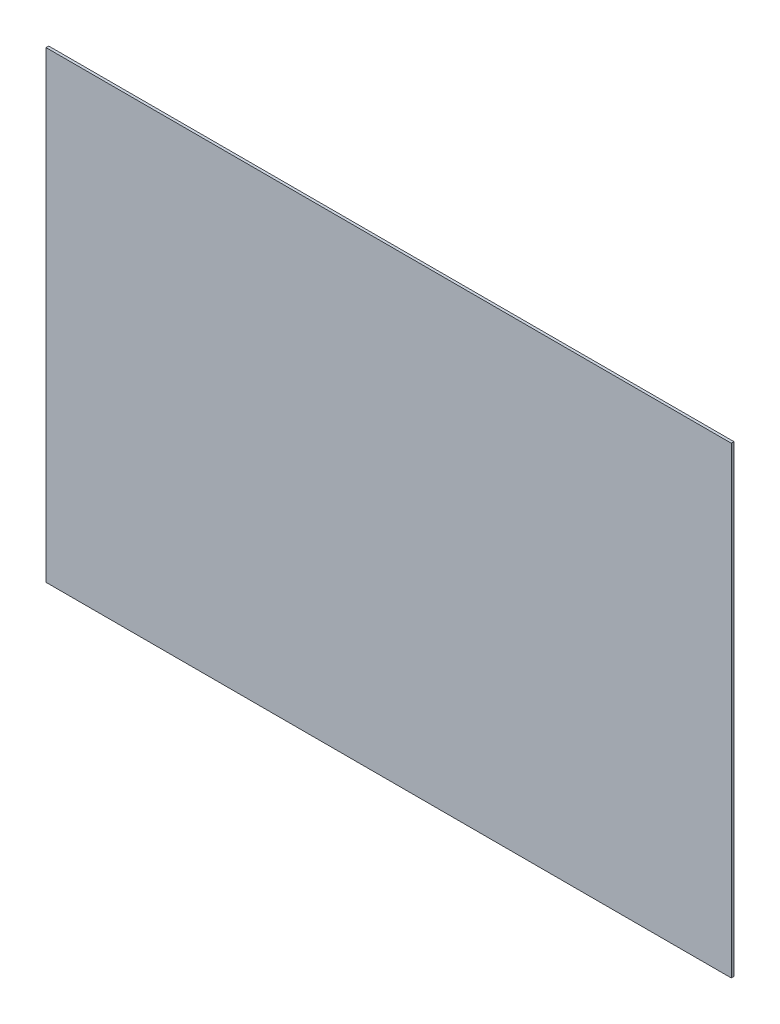
from build123d import *

# Parameters (mm, degrees)
SKETCH1_W           = 254.5
SKETCH1_H           = 172
BOSS_EXTRUDE1_DEPTH = 1
SKETCH2_W           = 230
SKETCH2_H           = 148
BOSS_EXTRUDE2_DEPTH = 9
SKETCH3_R           = 1.75
CUT_EXTRUDE1_DEPTH  = 2


with BuildPart() as part:
    # Sketch1 → Boss-Extrude1 (new body)
    with BuildSketch(Plane.XY):
        Rectangle(SKETCH1_W, SKETCH1_H)
    extrude(amount=BOSS_EXTRUDE1_DEPTH)

    # Sketch2 → Boss-Extrude2 (add)
    with BuildSketch(Plane(origin=(0, 0, 0), x_dir=(-1, 0, 0), z_dir=(0, 0, -1))):
        with Locations((0, -2.5)):
            Rectangle(SKETCH2_W, SKETCH2_H)
    extrude(amount=BOSS_EXTRUDE2_DEPTH)

    # Sketch3 → Cut-Extrude1 (cut)
    with BuildSketch(Plane(origin=(0, 0, -9), x_dir=(-1, 0, 0), z_dir=(0, 0, -1))):
        with Locations((29, -26.5)):
            Circle(SKETCH3_R)
        with Locations((-29, -26.5)):
            Circle(SKETCH3_R)
        with Locations((-29, 22.5)):
            Circle(SKETCH3_R)
        with Locations((29, 22.5)):
            Circle(SKETCH3_R)
    extrude(amount=-CUT_EXTRUDE1_DEPTH, mode=Mode.SUBTRACT)


solid = part.part
